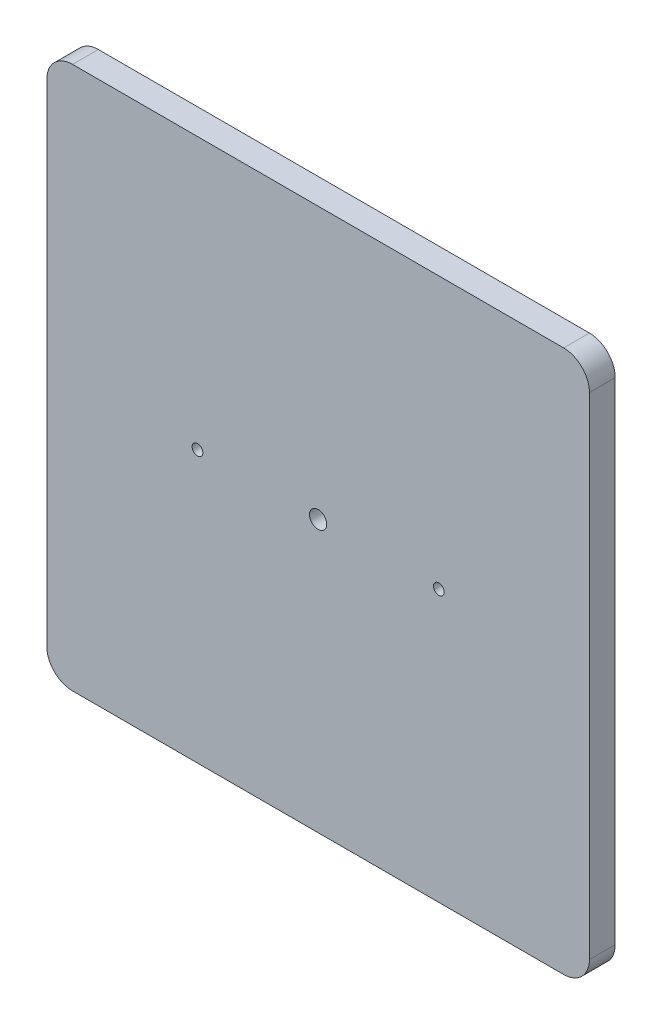
from build123d import *

# Parameters (mm, degrees)
BASEPLATE_W                      = 200
BASEPLATE_H                      = 200
BOSS_EXTRUDE1_DEPTH              = 9.5
FILLET1_R                        = 9.5
F_1_4_INCH_BOLT_HOLE_D           = 6.35
F_1_4_INCH_BOLT_HOLE_CSINK_D     = 7.62
F_1_4_INCH_BOLT_HOLE_CSINK_ANGLE = 90
F_5_32_DOWEL_HOLE_D              = 3.96875
F_5_32_DOWEL_HOLE_CSINK_D        = 5.23875
F_5_32_DOWEL_HOLE_CSINK_ANGLE    = 100


with BuildPart() as part:
    # Baseplate → Boss-Extrude1 (new body)
    with BuildSketch(Plane.XY):
        Rectangle(BASEPLATE_W, BASEPLATE_H)
    extrude(amount=BOSS_EXTRUDE1_DEPTH)

    # Fillet1
    fillet1_edges = [part.edges().sort_by_distance(p)[0] for p in [
        (100, -100, 4.75),
        (-100, -100, 4.75),
        (-100, 100, 4.75),
        (100, 100, 4.75),
    ]]
    fillet(fillet1_edges, radius=FILLET1_R)

    # 1/4 Inch Bolt Hole (through all)
    with Locations(Plane(origin=(0, 0, 0), x_dir=(-1, 0, 0), z_dir=(0, 0, -1))):
        with Locations((0, 0)):
            CounterSinkHole(F_1_4_INCH_BOLT_HOLE_D / 2, F_1_4_INCH_BOLT_HOLE_CSINK_D / 2, counter_sink_angle=F_1_4_INCH_BOLT_HOLE_CSINK_ANGLE)

    # 5/32 Dowel Hole (through all)
    with Locations(Plane(origin=(0, 0, 0), x_dir=(-1, 0, 0), z_dir=(0, 0, -1))):
        with Locations((-44.5, 0), (44.45, 0)):
            CounterSinkHole(F_5_32_DOWEL_HOLE_D / 2, F_5_32_DOWEL_HOLE_CSINK_D / 2, counter_sink_angle=F_5_32_DOWEL_HOLE_CSINK_ANGLE)


solid = part.part
